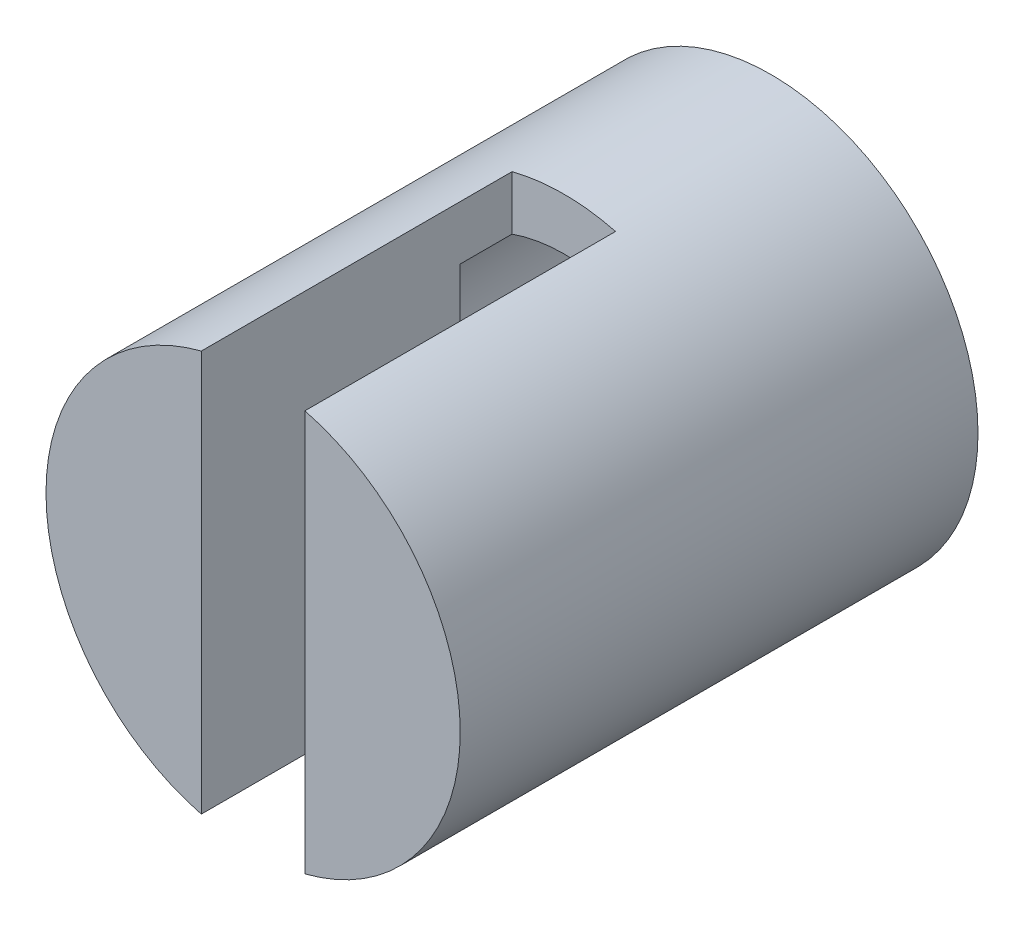
from build123d import *

# Parameters (mm, degrees)
CROQUIS1_R              = 4
SALIENTE_EXTRUIR1_DEPTH = 10
CROQUIS2_W              = 2
CROQUIS2_H              = 13.059807194
CORTAR_EXTRUIR1_DEPTH   = 6
CROQUIS3_R              = 3
CORTAR_EXTRUIR2_DEPTH   = 5


with BuildPart() as part:
    # Croquis1 → Saliente-Extruir1 (new body)
    with BuildSketch(Plane.XY):
        with Locations((0, 44.649122807)):
            Circle(CROQUIS1_R)
    extrude(amount=-SALIENTE_EXTRUIR1_DEPTH)

    # Croquis2 → Cortar-Extruir1 (cut)
    with BuildSketch(Plane.XY):
        with Locations((0, 44.649122807)):
            Rectangle(CROQUIS2_W, CROQUIS2_H)
    extrude(amount=-CORTAR_EXTRUIR1_DEPTH, mode=Mode.SUBTRACT)

    # Croquis3 → Cortar-Extruir2 (cut)
    with BuildSketch(Plane(origin=(0, 0, -10), x_dir=(-1, 0, 0), z_dir=(0, 0, -1))):
        with Locations((0, 44.649122807)):
            Circle(CROQUIS3_R)
    extrude(amount=-CORTAR_EXTRUIR2_DEPTH, mode=Mode.SUBTRACT)


solid = part.part
